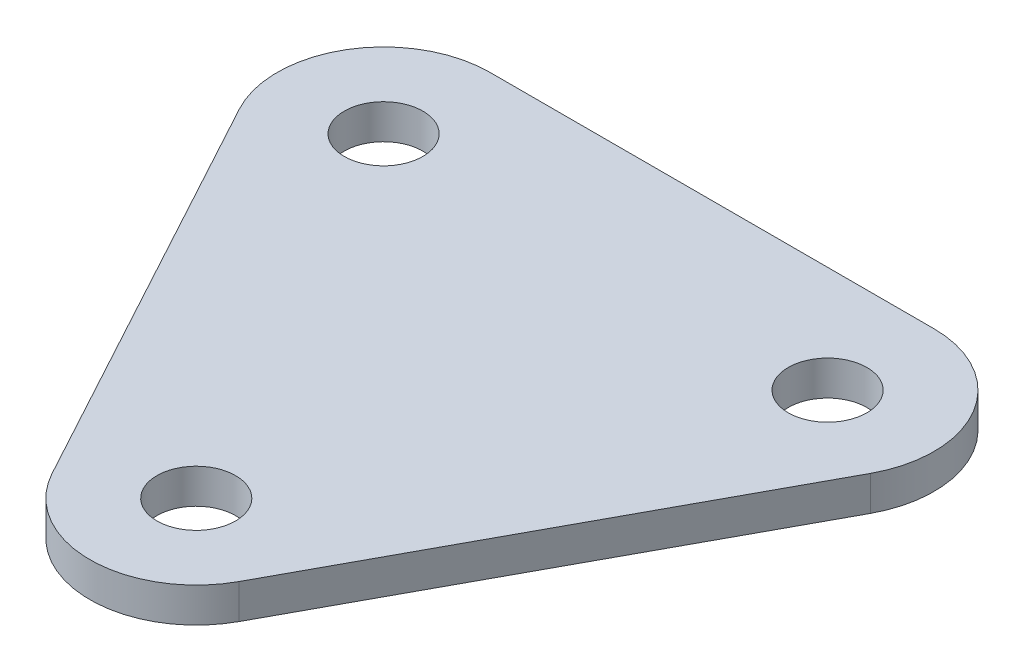
from build123d import *

# Parameters (mm, degrees)
SKETCH2_R           = 8.5
BOSS_EXTRUDE1_DEPTH = 7.5


with BuildPart() as part:
    # Sketch2 → Boss-Extrude1 (new body)
    with BuildSketch(Plane(origin=(0, 0, 0), x_dir=(1, 0, 0), z_dir=(0, 1, 0))):
        with BuildLine():
            Line((-48, 61.059418618), (48, 61.059418618))
            ThreePointArc((48, 61.059418618), (67.763699658, 49.82360902), (68.217732681, 27.093868689))
            Line((68.217732681, 27.093868689), (20.217732681, -61.406131311))
            ThreePointArc((20.217732681, -61.406131311), (0, -73.440581382), (-20.217732681, -61.406131311))
            Line((-20.217732681, -61.406131311), (-68.217732681, 27.093868689))
            ThreePointArc((-68.217732681, 27.093868689), (-67.763699658, 49.82360902), (-48, 61.059418618))
        make_face()
        with Locations(Location((48, 38.059418618, 0), (0, 0, 270))):
            Circle(SKETCH2_R, mode=Mode.SUBTRACT)
        with Locations(Location((0, -50.440581382, 0), (0, 0, 270))):
            Circle(SKETCH2_R, mode=Mode.SUBTRACT)
        with Locations(Location((-48, 38.059418618, 0), (0, 0, 270))):
            Circle(SKETCH2_R, mode=Mode.SUBTRACT)
    extrude(amount=BOSS_EXTRUDE1_DEPTH)


solid = part.part
